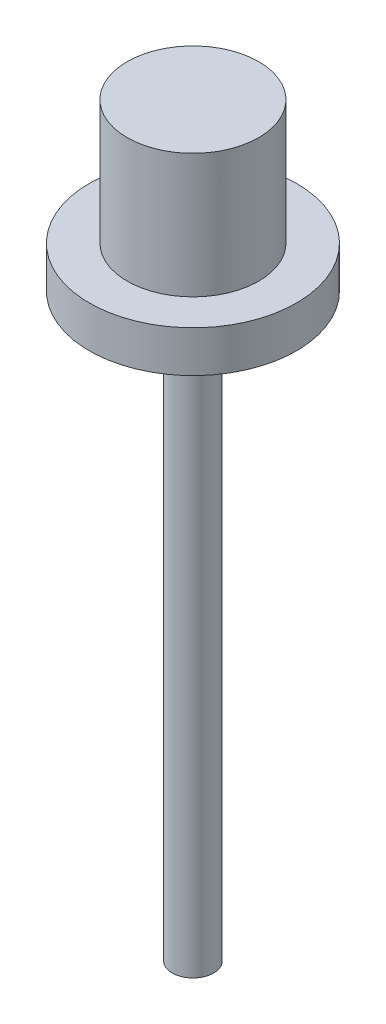
from build123d import *

# Parameters (mm, degrees)
SKETCH_1_R      = 3.175
EXTRUDE_1_DEPTH = 6
SKETCH_2_R      = 1
EXTRUDE_2_DEPTH = 30
SKETCH_3_R      = 5
EXTRUDE_3_DEPTH = 2


with BuildPart() as part:
    # 草图1 → 凸台-拉伸1 (new body)
    with BuildSketch(Plane(origin=(0, 0, 0), x_dir=(1, 0, 0), z_dir=(0, 1, 0))):
        with Locations(Location((0, 0, 0), (0, 0, 270))):
            Circle(SKETCH_1_R)
    extrude(amount=EXTRUDE_1_DEPTH)

    # 草图2 → 凸台-拉伸2 (add)
    with BuildSketch(Plane(origin=(0, 0, 0), x_dir=(-1, 0, 0), z_dir=(0, -1, 0))):
        with Locations(Location((0, 0, 0), (0, 0, 90))):
            Circle(SKETCH_2_R)
    extrude(amount=EXTRUDE_2_DEPTH)

    # 草图3 → 凸台-拉伸3 (add)
    with BuildSketch(Plane(origin=(0, 0, 0), x_dir=(-1, 0, 0), z_dir=(0, -1, 0))):
        with Locations(Location((0, 0, 0), (0, 0, 90))):
            Circle(SKETCH_3_R)
    extrude(amount=EXTRUDE_3_DEPTH)


solid = part.part
